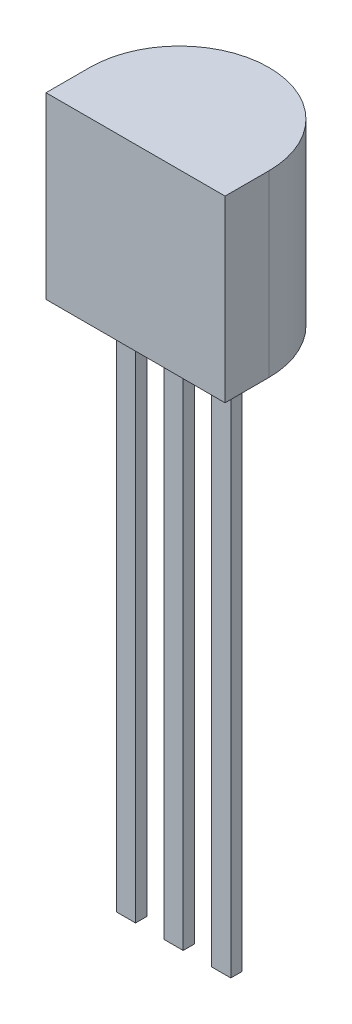
from build123d import *

# Parameters (mm, degrees)
EXTRUDE_1_DEPTH = 4.7
SKETCH_2_W      = 0.5
SKETCH_2_H      = 0.3
EXTRUDE_2_DEPTH = 14


with BuildPart() as part:
    # 草图1 → 凸台-拉伸1 (new body)
    with BuildSketch(Plane(origin=(0, 0, 0), x_dir=(1, 0, 0), z_dir=(0, 1, 0))):
        with BuildLine():
            Line((-2.35, 0), (2.35, 0))
            Line((2.35, 0), (2.35, 1.15))
            ThreePointArc((2.35, 1.15), (0, 3.5), (-2.35, 1.15))
            Line((-2.35, 1.15), (-2.35, 0))
        make_face()
    extrude(amount=EXTRUDE_1_DEPTH)

    # 草图2 → 凸台-拉伸2 (add)
    with BuildSketch(Plane.XZ):
        with Locations((1.25, -1.15)):
            Rectangle(SKETCH_2_W, SKETCH_2_H)
        with Locations((0, -1.15)):
            Rectangle(SKETCH_2_W, SKETCH_2_H)
        with Locations((-1.25, -1.15)):
            Rectangle(SKETCH_2_W, SKETCH_2_H)
    extrude(amount=EXTRUDE_2_DEPTH)


solid = part.part
